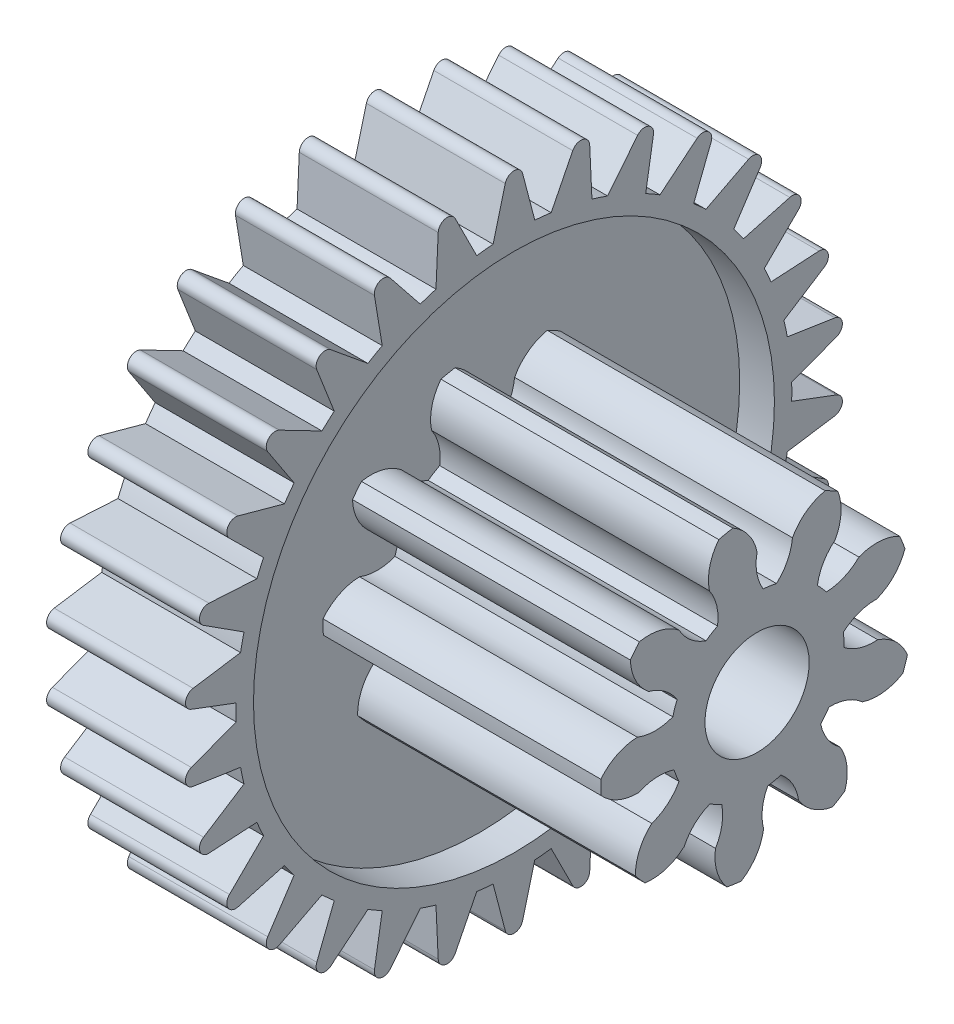
from build123d import *

# Parameters (mm, degrees)
SKETCH1_R           = 7.5
BOSS_EXTRUDE1_DEPTH = 4
SKETCH2_R           = 2.5
SKETCH2_R_2         = 1.5
BOSS_EXTRUDE2_DEPTH = 11
BOSS_EXTRUDE3_START = 2
SKETCH3_R           = 7.5
SKETCH3_R_2         = 2.5
BOSS_EXTRUDE3_DEPTH = 1
BOSS_EXTRUDE4_DEPTH = 8
CIRPATTERN1_COUNT   = 9


with BuildPart() as part:
    # Sketch1 → Boss-Extrude1 (new body)
    with BuildSketch(Plane(origin=(0, 0, 0), x_dir=(0, 0, -1), z_dir=(1, 0, 0))):
        with BuildLine():
            Line((0.6, 7.97746827), (0.25, 9.315399476))
            ThreePointArc((0.25, 9.315399476), (0, 9.508412638), (-0.25, 9.315399476))
            Line((-0.25, 9.315399476), (-0.6, 7.97746827))
            ThreePointArc((-0.6, 7.97746827), (-0.836227706, 7.956175163), (-1.071720356, 7.927888463))
            Line((-1.071720356, 7.927888463), (-1.692243556, 9.16381357))
            ThreePointArc((-1.692243556, 9.16381357), (-1.976910149, 9.300631009), (-2.181317356, 9.059857725))
            Line((-2.181317356, 9.059857725), (-2.245497477, 7.678394434))
            ThreePointArc((-2.245497477, 7.678394434), (-2.472135955, 7.60845213), (-2.69660139, 7.531821887))
            Line((-2.69660139, 7.531821887), (-3.560527947, 8.611725038))
            ThreePointArc((-3.560527947, 8.611725038), (-3.867419837, 8.686367175), (-4.017300676, 8.408356717))
            Line((-4.017300676, 8.408356717), (-3.792855939, 7.043737916))
            ThreePointArc((-3.792855939, 7.043737916), (-4, 6.92820323), (-4.203628003, 6.806578554))
            Line((-4.203628003, 6.806578554), (-5.273200183, 7.683262799))
            ThreePointArc((-5.273200183, 7.683262799), (-5.588904721, 7.692467414), (-5.67770868, 7.389370173))
            Line((-5.67770868, 7.389370173), (-5.174448396, 6.101236251))
            ThreePointArc((-5.174448396, 6.101236251), (-5.353044851, 5.945158604), (-5.526935901, 5.783855076))
            Line((-5.526935901, 5.783855076), (-6.755408266, 6.419005106))
            ThreePointArc((-6.755408266, 6.419005106), (-7.06612765, 6.362369914), (-7.08997357, 6.047432694))
            Line((-7.08997357, 6.047432694), (-6.329892629, 4.892081285))
            ThreePointArc((-6.329892629, 4.892081285), (-6.472135955, 4.702282018), (-6.60869018, 4.508349377))
            Line((-6.60869018, 4.508349377), (-7.942372593, 4.874206089))
            ThreePointArc((-7.942372593, 4.874206089), (-8.234526894, 4.754206319), (-8.192372593, 4.441193387))
            Line((-8.192372593, 4.441193387), (-7.20869018, 3.469118893))
            ThreePointArc((-7.20869018, 3.469118893), (-7.308363661, 3.253893145), (-7.401612985, 3.035807177))
            Line((-7.401612985, 3.035807177), (-8.782217125, 3.116380877))
            ThreePointArc((-8.782217125, 3.116380877), (-9.043037799, 2.938261095), (-8.936725622, 2.640852618))
            Line((-8.936725622, 2.640852618), (-7.772433378, 1.894539358))
            ThreePointArc((-7.772433378, 1.894539358), (-7.825180806, 1.663293527), (-7.871049786, 1.430585636))
            Line((-7.871049786, 1.430585636), (-9.238236627, 1.222354866))
            ThreePointArc((-9.238236627, 1.222354866), (-9.456324559, 0.993899761), (-9.290500859, 0.725093918))
            Line((-9.290500859, 0.725093918), (-7.996483942, 0.237159362))
            ThreePointArc((-7.996483942, 0.237159362), (-8, 0), (-7.996483942, -0.237159362))
            Line((-7.996483942, -0.237159362), (-9.290500859, -0.725093918))
            ThreePointArc((-9.290500859, -0.725093918), (-9.456324559, -0.993899761), (-9.238236627, -1.222354866))
            Line((-9.238236627, -1.222354866), (-7.871049786, -1.430585636))
            ThreePointArc((-7.871049786, -1.430585636), (-7.825180806, -1.663293527), (-7.772433378, -1.894539358))
            Line((-7.772433378, -1.894539358), (-8.936725622, -2.640852618))
            ThreePointArc((-8.936725622, -2.640852618), (-9.043037799, -2.938261095), (-8.782217125, -3.116380877))
            Line((-8.782217125, -3.116380877), (-7.401612985, -3.035807177))
            ThreePointArc((-7.401612985, -3.035807177), (-7.308363661, -3.253893145), (-7.20869018, -3.469118893))
            Line((-7.20869018, -3.469118893), (-8.192372593, -4.441193387))
            ThreePointArc((-8.192372593, -4.441193387), (-8.234526894, -4.754206319), (-7.942372593, -4.874206089))
            Line((-7.942372593, -4.874206089), (-6.60869018, -4.508349377))
            ThreePointArc((-6.60869018, -4.508349377), (-6.472135955, -4.702282018), (-6.329892629, -4.892081285))
            Line((-6.329892629, -4.892081285), (-7.08997357, -6.047432694))
            ThreePointArc((-7.08997357, -6.047432694), (-7.06612765, -6.362369914), (-6.755408266, -6.419005106))
            Line((-6.755408266, -6.419005106), (-5.526935901, -5.783855076))
            ThreePointArc((-5.526935901, -5.783855076), (-5.353044851, -5.945158604), (-5.174448396, -6.101236251))
            Line((-5.174448396, -6.101236251), (-5.67770868, -7.389370173))
            ThreePointArc((-5.67770868, -7.389370173), (-5.588904721, -7.692467414), (-5.273200183, -7.683262799))
            Line((-5.273200183, -7.683262799), (-4.203628003, -6.806578554))
            ThreePointArc((-4.203628003, -6.806578554), (-4, -6.92820323), (-3.792855939, -7.043737916))
            Line((-3.792855939, -7.043737916), (-4.017300676, -8.408356717))
            ThreePointArc((-4.017300676, -8.408356717), (-3.867419837, -8.686367175), (-3.560527947, -8.611725038))
            Line((-3.560527947, -8.611725038), (-2.69660139, -7.531821887))
            ThreePointArc((-2.69660139, -7.531821887), (-2.472135955, -7.60845213), (-2.245497477, -7.678394434))
            Line((-2.245497477, -7.678394434), (-2.181317356, -9.059857725))
            ThreePointArc((-2.181317356, -9.059857725), (-1.976910149, -9.300631009), (-1.692243556, -9.16381357))
            Line((-1.692243556, -9.16381357), (-1.071720356, -7.927888463))
            ThreePointArc((-1.071720356, -7.927888463), (-0.836227706, -7.956175163), (-0.6, -7.97746827))
            Line((-0.6, -7.97746827), (-0.25, -9.315399476))
            ThreePointArc((-0.25, -9.315399476), (0, -9.508412638), (0.25, -9.315399476))
            Line((0.25, -9.315399476), (0.6, -7.97746827))
            ThreePointArc((0.6, -7.97746827), (0.836227706, -7.956175163), (1.071720356, -7.927888463))
            Line((1.071720356, -7.927888463), (1.692243556, -9.16381357))
            ThreePointArc((1.692243556, -9.16381357), (1.976910149, -9.300631009), (2.181317356, -9.059857725))
            Line((2.181317356, -9.059857725), (2.245497477, -7.678394434))
            ThreePointArc((2.245497477, -7.678394434), (2.472135955, -7.60845213), (2.69660139, -7.531821887))
            Line((2.69660139, -7.531821887), (3.560527947, -8.611725038))
            ThreePointArc((3.560527947, -8.611725038), (3.867419837, -8.686367175), (4.017300676, -8.408356717))
            Line((4.017300676, -8.408356717), (3.792855939, -7.043737916))
            ThreePointArc((3.792855939, -7.043737916), (4, -6.92820323), (4.203628003, -6.806578554))
            Line((4.203628003, -6.806578554), (5.273200183, -7.683262799))
            ThreePointArc((5.273200183, -7.683262799), (5.588904721, -7.692467414), (5.67770868, -7.389370173))
            Line((5.67770868, -7.389370173), (5.174448396, -6.101236251))
            ThreePointArc((5.174448396, -6.101236251), (5.353044851, -5.945158604), (5.526935901, -5.783855076))
            Line((5.526935901, -5.783855076), (6.755408266, -6.419005106))
            ThreePointArc((6.755408266, -6.419005106), (7.06612765, -6.362369914), (7.08997357, -6.047432694))
            Line((7.08997357, -6.047432694), (6.329892629, -4.892081285))
            ThreePointArc((6.329892629, -4.892081285), (6.472135955, -4.702282018), (6.60869018, -4.508349377))
            Line((6.60869018, -4.508349377), (7.942372593, -4.874206089))
            ThreePointArc((7.942372593, -4.874206089), (8.234526894, -4.754206319), (8.192372593, -4.441193387))
            Line((8.192372593, -4.441193387), (7.20869018, -3.469118893))
            ThreePointArc((7.20869018, -3.469118893), (7.308363661, -3.253893145), (7.401612985, -3.035807177))
            Line((7.401612985, -3.035807177), (8.782217125, -3.116380877))
            ThreePointArc((8.782217125, -3.116380877), (9.043037799, -2.938261095), (8.936725622, -2.640852618))
            Line((8.936725622, -2.640852618), (7.772433378, -1.894539358))
            ThreePointArc((7.772433378, -1.894539358), (7.825180806, -1.663293527), (7.871049786, -1.430585636))
            Line((7.871049786, -1.430585636), (9.238236627, -1.222354866))
            ThreePointArc((9.238236627, -1.222354866), (9.456324559, -0.993899761), (9.290500859, -0.725093918))
            Line((9.290500859, -0.725093918), (7.996483942, -0.237159362))
            ThreePointArc((7.996483942, -0.237159362), (8, 0), (7.996483942, 0.237159362))
            Line((7.996483942, 0.237159362), (9.290500859, 0.725093918))
            ThreePointArc((9.290500859, 0.725093918), (9.456324559, 0.993899761), (9.238236627, 1.222354866))
            Line((9.238236627, 1.222354866), (7.871049786, 1.430585636))
            ThreePointArc((7.871049786, 1.430585636), (7.825180806, 1.663293527), (7.772433378, 1.894539358))
            Line((7.772433378, 1.894539358), (8.936725622, 2.640852618))
            ThreePointArc((8.936725622, 2.640852618), (9.043037799, 2.938261095), (8.782217125, 3.116380877))
            Line((8.782217125, 3.116380877), (7.401612985, 3.035807177))
            ThreePointArc((7.401612985, 3.035807177), (7.308363661, 3.253893145), (7.20869018, 3.469118893))
            Line((7.20869018, 3.469118893), (8.192372593, 4.441193387))
            ThreePointArc((8.192372593, 4.441193387), (8.234526894, 4.754206319), (7.942372593, 4.874206089))
            Line((7.942372593, 4.874206089), (6.60869018, 4.508349377))
            ThreePointArc((6.60869018, 4.508349377), (6.472135955, 4.702282018), (6.329892629, 4.892081285))
            Line((6.329892629, 4.892081285), (7.08997357, 6.047432694))
            ThreePointArc((7.08997357, 6.047432694), (7.06612765, 6.362369914), (6.755408266, 6.419005106))
            Line((6.755408266, 6.419005106), (5.526935901, 5.783855076))
            ThreePointArc((5.526935901, 5.783855076), (5.353044851, 5.945158604), (5.174448396, 6.101236251))
            Line((5.174448396, 6.101236251), (5.67770868, 7.389370173))
            ThreePointArc((5.67770868, 7.389370173), (5.588904721, 7.692467414), (5.273200183, 7.683262799))
            Line((5.273200183, 7.683262799), (4.203628003, 6.806578554))
            ThreePointArc((4.203628003, 6.806578554), (4, 6.92820323), (3.792855939, 7.043737916))
            Line((3.792855939, 7.043737916), (4.017300676, 8.408356717))
            ThreePointArc((4.017300676, 8.408356717), (3.867419837, 8.686367175), (3.560527947, 8.611725038))
            Line((3.560527947, 8.611725038), (2.69660139, 7.531821887))
            ThreePointArc((2.69660139, 7.531821887), (2.472135955, 7.60845213), (2.245497477, 7.678394434))
            Line((2.245497477, 7.678394434), (2.181317356, 9.059857725))
            ThreePointArc((2.181317356, 9.059857725), (1.976910149, 9.300631009), (1.692243556, 9.16381357))
            Line((1.692243556, 9.16381357), (1.071720356, 7.927888463))
            ThreePointArc((1.071720356, 7.927888463), (0.836227706, 7.956175163), (0.6, 7.97746827))
        make_face()
        Circle(SKETCH1_R, mode=Mode.SUBTRACT)
    extrude(amount=BOSS_EXTRUDE1_DEPTH)



with BuildPart() as body_2:
    # Sketch2 → Boss-Extrude2 (new body)
    with BuildSketch(Plane(origin=(0, 0, 0), x_dir=(0, 0, -1), z_dir=(1, 0, 0))):
        Circle(SKETCH2_R)
        Circle(SKETCH2_R_2, mode=Mode.SUBTRACT)
    extrude(amount=BOSS_EXTRUDE2_DEPTH)


with BuildPart() as part_1:
    add(part.part)

    add(body_2.part)  # Boss-Extrude3 merges body 2
    # Sketch3 → Boss-Extrude3 (add)
    with BuildSketch(Plane(origin=(0, 0, 0), x_dir=(0, 0, -1), z_dir=(1, 0, 0)).offset(BOSS_EXTRUDE3_START)):
        Circle(SKETCH3_R)
        Circle(SKETCH3_R_2, mode=Mode.SUBTRACT)
    extrude(amount=BOSS_EXTRUDE3_DEPTH)


with BuildPart() as body_2_2:
    # Sketch4 → Boss-Extrude4 (new body)
    with BuildSketch(Plane(origin=(3, 0, 0), x_dir=(0, 0, -1), z_dir=(1, 0, 0))):
        with BuildLine():
            ThreePointArc((0, 3.5), (-0.243843347, 4.049401719), (-0.695595786, 4.445913461))
            ThreePointArc((-0.695595786, 4.445913461), (-0.9, 4.409081537), (-1.102486985, 4.362857143))
            ThreePointArc((-1.102486985, 4.362857143), (-1.362698997, 3.821016266), (-1.371714256, 3.22))
            ThreePointArc((-1.371714256, 3.22), (-1.161063451, 2.745001063), (-1.138156241, 2.225893163))
            ThreePointArc((-1.138156241, 2.225893163), (-0.5, 2.449489743), (0.174735346, 2.493886036))
            ThreePointArc((0.174735346, 2.493886036), (-0.007637937, 2.98044306), (0, 3.5))
        make_face()
    boss_extrude4 = extrude(amount=BOSS_EXTRUDE4_DEPTH)


with BuildPart() as part_2:
    add(part_1.part)

    # CirPattern1: Boss-Extrude4 ×9 about axis
    cirpattern1_axis = Axis((0, 0, 0), (1, 0, 0))
    for i in range(1, CIRPATTERN1_COUNT):
        add(boss_extrude4.rotate(cirpattern1_axis, i * 360 / CIRPATTERN1_COUNT))


with BuildPart() as body_2_2_1:
    add(body_2_2.part)

    # Combine2: union part
    add(part_2.part)


solid = body_2_2_1.part
